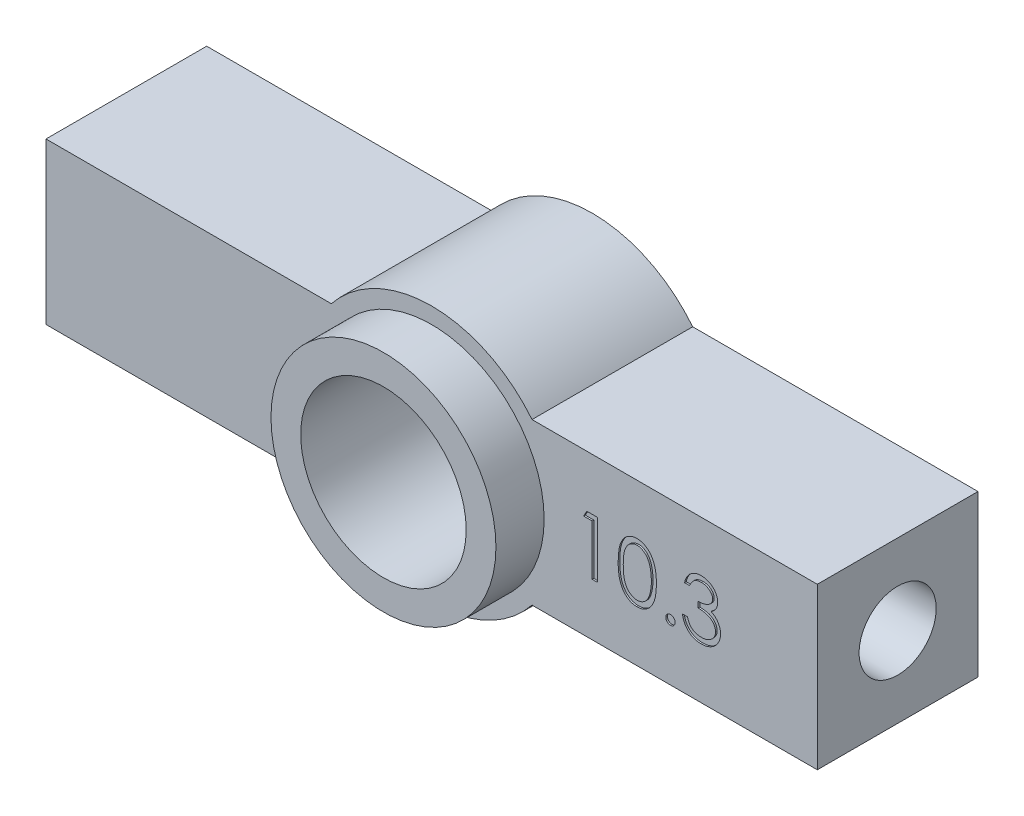
from build123d import *

# Parameters (mm, degrees)
SKETCH_1_R          = 5.15
EXTRUDE_1_DEPTH     = 10
SKETCH_3_R          = 2.4
CUT_EXTRUDE_1_DEPTH = 6
CUT_EXTRUDE_START   = -6
SKETCH_4_R          = 2.4
CUT_EXTRUDE_2_DEPTH = 6
CUT_EXTRUDE_4_DEPTH = 0.1
SKETCH_8_R          = 7
SKETCH_8_R_2        = 5.15
EXTRUDE_2_DEPTH     = 3


with BuildPart() as part:
    # ｽｹｯﾁ1 → ﾎﾞｽ - 押し出し1 (new body)
    with BuildSketch(Plane.XY):
        with BuildLine():
            Line((-6.244997998, 5), (-24, 5))
            Line((-24, 5), (-24, -5))
            Line((-24, -5), (-6.244997998, -5))
            ThreePointArc((-6.244997998, -5), (0, -8), (6.244997998, -5))
            Line((6.244997998, -5), (24, -5))
            Line((24, -5), (24, 5))
            Line((24, 5), (6.244997998, 5))
            ThreePointArc((6.244997998, 5), (0, 8), (-6.244997998, 5))
        make_face()
        Circle(SKETCH_1_R, mode=Mode.SUBTRACT)
    extrude(amount=EXTRUDE_1_DEPTH)

    # ｽｹｯﾁ3 → ｶｯﾄ - 押し出し1 (cut)
    with BuildSketch(Plane(origin=(24, 0, 0), x_dir=(0, 0, -1), z_dir=(1, 0, 0))):
        with Locations((-5, 0)):
            Circle(SKETCH_3_R)
    extrude(amount=-CUT_EXTRUDE_1_DEPTH, mode=Mode.SUBTRACT)

    # ｽｹｯﾁ4 → ｶｯﾄ - 押し出し2 (cut)
    with BuildSketch(Plane.ZY.offset(24).offset(CUT_EXTRUDE_START)):
        with Locations(Location((5, 0, 0), (0, 0, 180))):
            Circle(SKETCH_4_R)
    extrude(amount=CUT_EXTRUDE_2_DEPTH, mode=Mode.SUBTRACT)

    # ｽｹｯﾁ7 → ｶｯﾄ - 押し出し4 (cut)
    # profile 1 of 4: a face of its own
    with BuildSketch(Plane.XY.offset(10)):
        Polygon((9.65970299, 1.764483114), (10.306838406, 1.764483114), (10.306838406, -1.735516886), (9.992735842, -1.735516886), (9.992735842, 1.405508755), (9.454274304, 1.405508755), align=None)
    # profile 2 of 4: a face of its own
    with BuildSketch(Plane.XY.offset(10)):
        with BuildLine():
            add(Edge.make_bspline(
                [(11.608120458, 0.01308087), (11.608448476, 0.069178258), (11.609085656, 0.178148242), (11.616174077, 0.336932884), (11.627949419, 0.485893173), (11.644086792, 0.625036239), (11.663724772, 0.754398004), (11.689940259, 0.873632761), (11.719753061, 0.983292367), (11.754305507, 1.083734416), (11.793293296, 1.176312119), (11.835727557, 1.26273732), (11.883292351, 1.342879252), (11.933269264, 1.418017043), (11.987681336, 1.486920738), (12.044980126, 1.5505634), (12.107402003, 1.607474151), (12.172825011, 1.659320453), (12.241841475, 1.704769925), (12.312484141, 1.744802663), (12.385239247, 1.779002531), (12.46030543, 1.805892966), (12.537007988, 1.828103813), (12.615615055, 1.843292761), (12.696256419, 1.852849669), (12.750687854, 1.853763337), (12.778292733, 1.854226703)],
                knots=[0, 0, 0, 0, 1.646270934, 3.197905019, 4.663502075, 6.030701355, 7.308322542, 8.50163776, 9.611534131, 10.641858119, 11.616356847, 12.558055219, 13.465016945, 14.349605745, 15.204443733, 16.039544428, 16.859896111, 17.680448484, 18.487036065, 19.28249412, 20.06191084, 20.843045899, 21.620316918, 22.403196591, 23.190181807, 24, 24, 24, 24], degree=3))
            add(Edge.make_bspline(
                [(12.778292733, 1.854226703), (12.806128212, 1.853738888), (12.861484221, 1.852768777), (12.943324596, 1.843444835), (13.023274278, 1.827973712), (13.100992416, 1.806052737), (13.177117403, 1.77885706), (13.251053811, 1.744769943), (13.323260892, 1.705091076), (13.39259118, 1.658467199), (13.459805795, 1.606484922), (13.523253758, 1.547722254), (13.582940844, 1.482772534), (13.639616149, 1.41233067), (13.691671746, 1.335045586), (13.741245179, 1.252261476), (13.785617215, 1.162530611), (13.82835189, 1.067350143), (13.865238877, 0.964086484), (13.898505122, 0.853321724), (13.92538409, 0.733747537), (13.947773363, 0.605991292), (13.965118259, 0.469583808), (13.977750901, 0.324817493), (13.984423986, 0.171597102), (13.985680687, 0.066839253), (13.986325586, 0.01308087)],
                knots=[0, 0, 0, 0, 0.810914788, 1.612654377, 2.396697861, 3.181598691, 3.963628158, 4.749916497, 5.551656086, 6.361998678, 7.18212741, 8.025565596, 8.878627764, 9.750805457, 10.657531673, 11.591944965, 12.560506719, 13.57287815, 14.630710178, 15.753379473, 16.941251878, 18.199788006, 19.531962791, 20.947069417, 22.433333509, 24, 24, 24, 24], degree=3))
            add(Edge.make_bspline(
                [(13.986325586, 0.01308087), (13.985674001, -0.040443038), (13.984404415, -0.14473219), (13.977825709, -0.297263165), (13.964867078, -0.441261208), (13.948657089, -0.577071671), (13.926206126, -0.70412929), (13.89860096, -0.822873738), (13.867950637, -0.93381781), (13.830115843, -1.036052622), (13.788705133, -1.131004344), (13.743649937, -1.219671493), (13.69538011, -1.302837785), (13.642791365, -1.379837532), (13.586737952, -1.451216189), (13.526020163, -1.515713812), (13.462349578, -1.574884484), (13.394937163, -1.627536111), (13.324525611, -1.673620916), (13.252566534, -1.714834766), (13.177783151, -1.748067462), (13.101870198, -1.776602503), (13.023741832, -1.798402954), (12.943495441, -1.81347681), (12.861539206, -1.824048658), (12.80613764, -1.824855138), (12.778292733, -1.825260476)],
                knots=[0, 0, 0, 0, 1.561518951, 3.042555995, 4.452378317, 5.7783523, 7.031515105, 8.214008947, 9.334062868, 10.386615937, 11.391082383, 12.354592575, 13.286541444, 14.194233754, 15.072674879, 15.931287219, 16.775624067, 17.606195743, 18.42308326, 19.229000347, 20.022332153, 20.807536673, 21.593273796, 22.3848459, 23.188221202, 24, 24, 24, 24], degree=3))
            add(Edge.make_bspline(
                [(12.778292733, -1.825260476), (12.750688619, -1.824794121), (12.696258695, -1.823874559), (12.615606269, -1.814360827), (12.537323826, -1.799065324), (12.461025072, -1.77764872), (12.386318557, -1.751433884), (12.31422227, -1.7172802), (12.243934586, -1.677946131), (12.17564303, -1.63315071), (12.110630869, -1.581829027), (12.048532264, -1.525064738), (11.990907245, -1.461441327), (11.937273149, -1.391963403), (11.886299061, -1.317270161), (11.839409688, -1.236341788), (11.796038834, -1.149499178), (11.756395343, -1.056181267), (11.721246679, -0.955026339), (11.690198971, -0.844877161), (11.665684814, -0.724761524), (11.644701858, -0.595644157), (11.627777475, -0.456970227), (11.61622315, -0.308664449), (11.609081835, -0.15081924), (11.608446765, -0.042549466), (11.608120458, 0.01308087)],
                knots=[0, 0, 0, 0, 0.810891512, 1.598919785, 2.382837074, 3.152667961, 3.926044502, 4.706494248, 5.493654104, 6.291793342, 7.103789334, 7.925228297, 8.761435821, 9.622817696, 10.50288917, 11.416980706, 12.369136599, 13.353924996, 14.394355917, 15.514179734, 16.714354668, 17.994756427, 19.357759367, 20.818452758, 22.365282078, 24, 24, 24, 24], degree=3))
        make_face()
        with BuildLine():
            add(Edge.make_bspline(
                [(11.922223022, 0.014483114), (11.922342469, -0.032265585), (11.922574292, -0.12299563), (11.928630493, -0.254838891), (11.936880725, -0.37780922), (11.947522022, -0.492062756), (11.96332497, -0.597212769), (11.981031758, -0.693982452), (12.002579848, -0.781859689), (12.028074866, -0.8614475), (12.057113963, -0.934096568), (12.088819826, -1.001697783), (12.122880549, -1.06504972), (12.1609997, -1.123583328), (12.202514763, -1.177489492), (12.246488022, -1.227722325), (12.294560606, -1.272519306), (12.361064349, -1.326246161), (12.448860823, -1.381765295), (12.559481279, -1.430111384), (12.67314973, -1.460493841), (12.75030098, -1.464357597), (12.78880956, -1.466286117)],
                knots=[0, 0, 0, 0, 1.459021318, 2.831673884, 4.118529203, 5.306027144, 6.411944654, 7.436330062, 8.375795394, 9.233974572, 10.042671642, 10.816086306, 11.563610507, 12.285937304, 12.993564865, 13.685989202, 14.367179055, 15.041617293, 16.353048772, 17.594441528, 18.799311195, 20, 20, 20, 20], degree=3))
            add(Edge.make_bspline(
                [(12.78880956, -1.466286117), (12.827567232, -1.464688336), (12.905002555, -1.461496074), (13.01813635, -1.430697336), (13.12796662, -1.384227797), (13.214038561, -1.329280291), (13.279521104, -1.276951962), (13.326438094, -1.232337314), (13.369500143, -1.182381446), (13.410342218, -1.12848215), (13.447801293, -1.069609666), (13.481864431, -1.006047091), (13.512947778, -0.937617913), (13.530656824, -0.889848174), (13.539711003, -0.865424739)],
                knots=[0, 0, 0, 0, 1.353760809, 2.704726607, 4.075137775, 5.516104923, 6.260822281, 7.007110065, 7.778089737, 8.566572457, 9.372053459, 10.217411131, 11.088608312, 12, 12, 12, 12], degree=3))
            add(Edge.make_bspline(
                [(13.539711003, -0.865424739), (13.55026277, -0.834195), (13.571687384, -0.770785235), (13.599299158, -0.672421583), (13.621044558, -0.569218819), (13.640607923, -0.461793703), (13.653960979, -0.349354002), (13.664708793, -0.232247618), (13.67103948, -0.110386255), (13.671824231, -0.027591264), (13.672223022, 0.014483114)],
                knots=[0, 0, 0, 0, 0.884706709, 1.796334032, 2.740027952, 3.714592787, 4.726048262, 5.777819803, 6.87074269, 8, 8, 8, 8], degree=3))
            add(Edge.make_bspline(
                [(13.672223022, 0.014483114), (13.671672833, 0.056550686), (13.670596545, 0.138843851), (13.666482557, 0.259362031), (13.655858983, 0.373829792), (13.644059864, 0.482740265), (13.626662643, 0.585490568), (13.607904836, 0.682940873), (13.582703624, 0.773883898), (13.555783849, 0.85974348), (13.524973453, 0.939544134), (13.491057719, 1.01365792), (13.45483596, 1.082442645), (13.41549372, 1.145709587), (13.373498036, 1.20374213), (13.327740487, 1.255376724), (13.280036114, 1.302213692), (13.213218929, 1.355676261), (13.125744639, 1.410187957), (13.016898991, 1.460353717), (12.903628347, 1.489162009), (12.827054893, 1.493223696), (12.78880956, 1.495252344)],
                knots=[0, 0, 0, 0, 1.31362396, 2.569729283, 3.763502607, 4.902122613, 5.988968491, 7.01645872, 7.998833611, 8.933434873, 9.825090667, 10.667526885, 11.477055099, 12.250526234, 12.991942729, 13.710640831, 14.402115721, 15.076753259, 16.378508321, 17.609869233, 18.806226677, 20, 20, 20, 20], degree=3))
            add(Edge.make_bspline(
                [(12.78880956, 1.495252344), (12.750098968, 1.493220898), (12.672607263, 1.489154304), (12.558159308, 1.46046105), (12.448454956, 1.410448084), (12.361211982, 1.355495712), (12.294348195, 1.3031574), (12.247265502, 1.257770946), (12.203119329, 1.208124692), (12.162451629, 1.153722777), (12.124362346, 1.09525741), (12.089381334, 1.032268645), (12.057864004, 0.964437281), (12.028779468, 0.891820845), (12.00320668, 0.812239901), (11.982112716, 0.724470907), (11.962625663, 0.628009015), (11.948830394, 0.522289507), (11.936566639, 0.408007354), (11.928685291, 0.284730036), (11.922554033, 0.152665655), (11.922335569, 0.061466497), (11.922223022, 0.014483114)],
                knots=[0, 0, 0, 0, 1.207732386, 2.417664972, 3.655092373, 4.956220595, 5.625982001, 6.301752483, 6.994047911, 7.697131622, 8.419323945, 9.170223765, 9.943494443, 10.752040957, 11.610060368, 12.549350801, 13.567764191, 14.679664412, 15.874934091, 17.154273443, 18.533957287, 20, 20, 20, 20], degree=3))
        make_face(mode=Mode.SUBTRACT)
    # profile 3 of 4: a face of its own
    with BuildSketch(Plane.XY.offset(10)):
        with BuildLine():
            add(Edge.make_bspline(
                [(14.861325586, -1.197055348), (14.880815798, -1.198213515), (14.91902408, -1.200483965), (14.974263209, -1.216060639), (15.024257869, -1.243719299), (15.068790113, -1.280582078), (15.10549659, -1.325277741), (15.134140942, -1.37487365), (15.149581927, -1.430575242), (15.151835839, -1.469004917), (15.152992253, -1.488722015)],
                knots=[0, 0, 0, 0, 1.020151414, 1.999887582, 2.974338812, 3.990962822, 5.007586832, 5.987933904, 6.967670073, 8, 8, 8, 8], degree=3))
            add(Edge.make_bspline(
                [(15.152992253, -1.488722015), (15.151796652, -1.507965344), (15.149438945, -1.545912908), (15.134176337, -1.601194371), (15.105278286, -1.650821275), (15.069043293, -1.696123413), (15.02424686, -1.733064284), (14.974145013, -1.760487629), (14.919153755, -1.777179609), (14.880837432, -1.779305906), (14.861325586, -1.780388681)],
                knots=[0, 0, 0, 0, 1.009421747, 1.99056486, 2.972319754, 3.999869655, 5.017953583, 5.993804169, 6.978383603, 8, 8, 8, 8], degree=3))
            add(Edge.make_bspline(
                [(14.861325586, -1.780388681), (14.84179968, -1.779345084), (14.803679998, -1.777307709), (14.748894003, -1.760144903), (14.698487035, -1.733321443), (14.653699323, -1.696054533), (14.617160852, -1.65105439), (14.589535469, -1.600852593), (14.57294532, -1.546071156), (14.570763447, -1.507996513), (14.569658919, -1.488722015)],
                knots=[0, 0, 0, 0, 1.022052826, 1.995314843, 2.982371812, 4.00089066, 5.028879526, 6.005146991, 6.990147033, 8, 8, 8, 8], degree=3))
            add(Edge.make_bspline(
                [(14.569658919, -1.488722015), (14.570721019, -1.468972635), (14.572794637, -1.430414395), (14.589570297, -1.375215288), (14.616946509, -1.325046848), (14.653951904, -1.280650268), (14.6984762, -1.243462966), (14.748772405, -1.216398172), (14.803811945, -1.20035776), (14.841821884, -1.198175243), (14.861325586, -1.197055348)],
                knots=[0, 0, 0, 0, 1.032775665, 2.016367738, 2.991239715, 4.008302682, 5.025365648, 6.011011707, 6.979408107, 8, 8, 8, 8], degree=3))
        make_face()
    # profile 4 of 4: a face of its own
    with BuildSketch(Plane.XY.offset(10)):
        with BuildLine():
            Line((16.05042815, 0.956790806), (15.736325586, 0.956790806))
            add(Edge.make_bspline(
                [(15.736325586, 0.956790806), (15.744835137, 0.99202329), (15.761470612, 1.060899914), (15.796168186, 1.159307175), (15.833967441, 1.252430696), (15.879356545, 1.33852677), (15.9288653, 1.419325673), (15.985588021, 1.492994797), (16.046907744, 1.561407763), (16.114732693, 1.622121), (16.185861355, 1.67709873), (16.261295974, 1.723973787), (16.339518868, 1.76429794), (16.421072001, 1.797518172), (16.506198173, 1.822543695), (16.594127796, 1.840700501), (16.685091296, 1.852491615), (16.746838887, 1.853642378), (16.778192573, 1.854226703)],
                knots=[0, 0, 0, 0, 1.162005537, 2.271625781, 3.343758855, 4.383309926, 5.390229558, 6.379919256, 7.361854164, 8.333198761, 9.295911338, 10.242430842, 11.177959212, 12.116337295, 13.062827104, 14.020064771, 14.994644689, 16, 16, 16, 16], degree=3))
            add(Edge.make_bspline(
                [(16.778192573, 1.854226703), (16.823875315, 1.852847473), (16.914244326, 1.850119098), (17.047007373, 1.825204661), (17.175034192, 1.785779529), (17.29692344, 1.731305802), (17.410141873, 1.664118488), (17.510878059, 1.584153752), (17.59776657, 1.49295445), (17.670660948, 1.392221886), (17.727735947, 1.284566376), (17.76982232, 1.173766219), (17.795444001, 1.060084248), (17.798764558, 0.983326969), (17.80042815, 0.944871735)],
                knots=[0, 0, 0, 0, 1.083050992, 2.142477498, 3.193116406, 4.255571735, 5.30263384, 6.308962982, 7.297363603, 8.282367274, 9.249857812, 10.179914175, 11.08814088, 12, 12, 12, 12], degree=3))
            add(Edge.make_bspline(
                [(17.80042815, 0.944871735), (17.799264559, 0.907864941), (17.796987592, 0.835448386), (17.777653886, 0.729726889), (17.745117623, 0.630085289), (17.700047861, 0.536104127), (17.641706311, 0.448379287), (17.571033614, 0.366713396), (17.487530952, 0.290744238), (17.424252014, 0.247224765), (17.391674144, 0.224819652)],
                knots=[0, 0, 0, 0, 1.024540389, 2.004866551, 2.965041327, 3.920577974, 4.882998113, 5.874504559, 6.905732034, 8, 8, 8, 8], degree=3))
            add(Edge.make_bspline(
                [(17.391674144, 0.224819652), (17.428905898, 0.20684148), (17.502672772, 0.171221523), (17.603223302, 0.101365765), (17.694501177, 0.020709418), (17.745404896, -0.042233235), (17.770981035, -0.073858233)],
                knots=[0, 0, 0, 0, 1.015518401, 2.012035669, 3.001164323, 4, 4, 4, 4], degree=3))
            add(Edge.make_bspline(
                [(17.770981035, -0.073858233), (17.787822377, -0.096915984), (17.821229273, -0.142653901), (17.862464807, -0.216190327), (17.899873921, -0.290541816), (17.92902414, -0.367701222), (17.951598007, -0.446774236), (17.96773404, -0.527896632), (17.97775818, -0.611134654), (17.979193732, -0.667447134), (17.97991533, -0.695753265)],
                knots=[0, 0, 0, 0, 1.025084078, 2.033381695, 3.024893161, 4.013698104, 4.991890475, 5.976764909, 6.982997093, 8, 8, 8, 8], degree=3))
            add(Edge.make_bspline(
                [(17.97991533, -0.695753265), (17.978120816, -0.744762986), (17.974540234, -0.842551788), (17.94253616, -0.987026509), (17.892922919, -1.128252012), (17.822465983, -1.263326851), (17.736598474, -1.389707232), (17.63444115, -1.502783541), (17.517154742, -1.599982145), (17.386349093, -1.681192373), (17.244631964, -1.746110295), (17.093056372, -1.791167738), (16.933806318, -1.820513738), (16.824599021, -1.823660607), (16.76907799, -1.825260476)],
                knots=[0, 0, 0, 0, 0.955779014, 1.907060117, 2.875433937, 3.871313158, 4.872415639, 5.851225146, 6.836215519, 7.83643374, 8.849228613, 9.86973379, 10.916971861, 12, 12, 12, 12], degree=3))
            add(Edge.make_bspline(
                [(16.76907799, -1.825260476), (16.731658689, -1.824392263), (16.658029984, -1.822683909), (16.549786486, -1.811005308), (16.446464787, -1.789675302), (16.347925189, -1.760971997), (16.254080152, -1.724580255), (16.165216047, -1.679261557), (16.080786154, -1.625950055), (16.001587203, -1.564016467), (15.927628635, -1.494735127), (15.860875911, -1.416876117), (15.800216118, -1.331878713), (15.747273479, -1.238755657), (15.699636526, -1.1387104), (15.66045557, -1.030461902), (15.625970001, -0.91497788), (15.609936537, -0.834500139), (15.601710201, -0.793209194)],
                knots=[0, 0, 0, 0, 1.048658725, 2.063410685, 3.046034179, 4.001477787, 4.936774919, 5.862367409, 6.792675028, 7.730719943, 8.675894397, 9.627829632, 10.600096036, 11.597688215, 12.626045268, 13.701542398, 14.82072376, 16, 16, 16, 16], degree=3))
            Line((15.601710201, -0.793209194), (15.915812765, -0.793209194))
            add(Edge.make_bspline(
                [(15.915812765, -0.793209194), (15.923996057, -0.820158207), (15.93991327, -0.872576379), (15.967007568, -0.948016685), (15.99787584, -1.017174738), (16.030990398, -1.08055786), (16.065768844, -1.138790262), (16.104683769, -1.190332131), (16.144852915, -1.237447334), (16.175132268, -1.263991946), (16.189951387, -1.276983233)],
                knots=[0, 0, 0, 0, 1.198163088, 2.33053128, 3.407730985, 4.417276592, 5.372219308, 6.28897303, 7.162600585, 8, 8, 8, 8], degree=3))
            add(Edge.make_bspline(
                [(16.189951387, -1.276983233), (16.209547964, -1.292091567), (16.248680627, -1.322261598), (16.312448858, -1.360763227), (16.379513744, -1.394124252), (16.451328418, -1.419607948), (16.526343188, -1.441185609), (16.605770554, -1.455306128), (16.688909771, -1.464994299), (16.745677534, -1.465849231), (16.774686964, -1.466286117)],
                knots=[0, 0, 0, 0, 0.946170439, 1.889420265, 2.845303464, 3.807233317, 4.801018734, 5.828864929, 6.890507805, 8, 8, 8, 8], degree=3))
            add(Edge.make_bspline(
                [(16.774686964, -1.466286117), (16.807440467, -1.465670212), (16.871487114, -1.464465862), (16.964941973, -1.453390156), (17.053849421, -1.437259742), (17.137222346, -1.412346759), (17.216152854, -1.381565908), (17.289534503, -1.342917502), (17.35833061, -1.297572781), (17.421660015, -1.246033622), (17.478605522, -1.189612127), (17.528745036, -1.130599056), (17.571369697, -1.069243226), (17.605753275, -1.005205106), (17.632903826, -0.938749877), (17.651387026, -0.869691047), (17.664238541, -0.798593781), (17.665285154, -0.750264812), (17.665812765, -0.725901502)],
                knots=[0, 0, 0, 0, 1.217147791, 2.380027433, 3.494444702, 4.572153297, 5.609568379, 6.639424714, 7.649109417, 8.668170816, 9.669597737, 10.625200337, 11.543417969, 12.441394052, 13.322311151, 14.205496177, 15.095365482, 16, 16, 16, 16], degree=3))
            add(Edge.make_bspline(
                [(17.665812765, -0.725901502), (17.664282464, -0.693290163), (17.661229475, -0.628229755), (17.637920896, -0.53251218), (17.599582032, -0.440288768), (17.54590952, -0.353132978), (17.480573792, -0.272357076), (17.404208885, -0.200285594), (17.316180657, -0.140815503), (17.235160788, -0.099726846), (17.163395631, -0.071689771), (17.101980247, -0.053014807), (17.033223643, -0.037201151), (16.957957294, -0.02248888), (16.875614078, -0.009967531), (16.78628364, 0.000474284), (16.689947878, 0.008829325), (16.623256712, 0.01256042), (16.588889688, 0.014483114)],
                knots=[0, 0, 0, 0, 1.07054697, 2.135767047, 3.216561865, 4.33974944, 5.486079747, 6.621378074, 7.775625952, 8.963672916, 9.598146892, 10.304877434, 11.070270905, 11.915000392, 12.823868403, 13.805723172, 14.86925407, 16, 16, 16, 16], degree=3))
            Line((16.588889688, 0.014483114), (16.588889688, 0.373457473))
            add(Edge.make_bspline(
                [(16.588889688, 0.373457473), (16.632190854, 0.374192276), (16.717007201, 0.375631576), (16.840901506, 0.393039587), (16.959374818, 0.417120215), (17.06980156, 0.454005407), (17.170450273, 0.496845704), (17.257769875, 0.546697913), (17.330537022, 0.602112663), (17.388398094, 0.663945272), (17.431927323, 0.730260319), (17.46375412, 0.799376977), (17.482554446, 0.871901038), (17.485064113, 0.921395706), (17.486325586, 0.946273979)],
                knots=[0, 0, 0, 0, 1.321986639, 2.589447074, 3.816329219, 5.01088745, 6.139805852, 7.153945165, 8.075214402, 8.924034688, 9.728124013, 10.488707548, 11.240355623, 12, 12, 12, 12], degree=3))
            add(Edge.make_bspline(
                [(17.486325586, 0.946273979), (17.485911175, 0.964551724), (17.485086724, 1.000914431), (17.474689446, 1.0540395), (17.459065405, 1.105540446), (17.437585676, 1.155198256), (17.408835477, 1.20266853), (17.374429491, 1.248355979), (17.33346139, 1.291999758), (17.286515943, 1.332680077), (17.236104138, 1.371449315), (17.180854363, 1.404362952), (17.122432489, 1.432508014), (17.060773834, 1.455717516), (16.995678304, 1.473176804), (16.927451746, 1.485712645), (16.855964062, 1.4935503), (16.80719233, 1.494678716), (16.782399304, 1.495252344)],
                knots=[0, 0, 0, 0, 0.884392785, 1.759457502, 2.611959086, 3.489218968, 4.37281399, 5.2945488, 6.255912374, 7.266815255, 8.301784654, 9.332968512, 10.37626691, 11.440494194, 12.520033166, 13.637162961, 14.798855837, 16, 16, 16, 16], degree=3))
            add(Edge.make_bspline(
                [(16.782399304, 1.495252344), (16.742547636, 1.493860982), (16.664708059, 1.491143329), (16.552493143, 1.467340315), (16.448173809, 1.429362232), (16.368435142, 1.384029212), (16.309552568, 1.339278778), (16.26747563, 1.300196392), (16.226155119, 1.256763568), (16.188309442, 1.206305193), (16.150035466, 1.152238403), (16.115190904, 1.091814721), (16.081331212, 1.026610327), (16.060928662, 0.980514693), (16.05042815, 0.956790806)],
                knots=[0, 0, 0, 0, 1.472543308, 2.876219568, 4.221790263, 5.565193594, 6.249813518, 6.953379497, 7.687249741, 8.463570142, 9.283606569, 10.136032583, 11.040678096, 12, 12, 12, 12], degree=3))
        make_face()
    extrude(amount=-CUT_EXTRUDE_4_DEPTH, mode=Mode.SUBTRACT)

    # ｽｹｯﾁ8 → ﾎﾞｽ - 押し出し2 (add)
    with BuildSketch(Plane.XY.offset(10)):
        Circle(SKETCH_8_R)
        Circle(SKETCH_8_R_2, mode=Mode.SUBTRACT)
    extrude(amount=EXTRUDE_2_DEPTH)


solid = part.part
